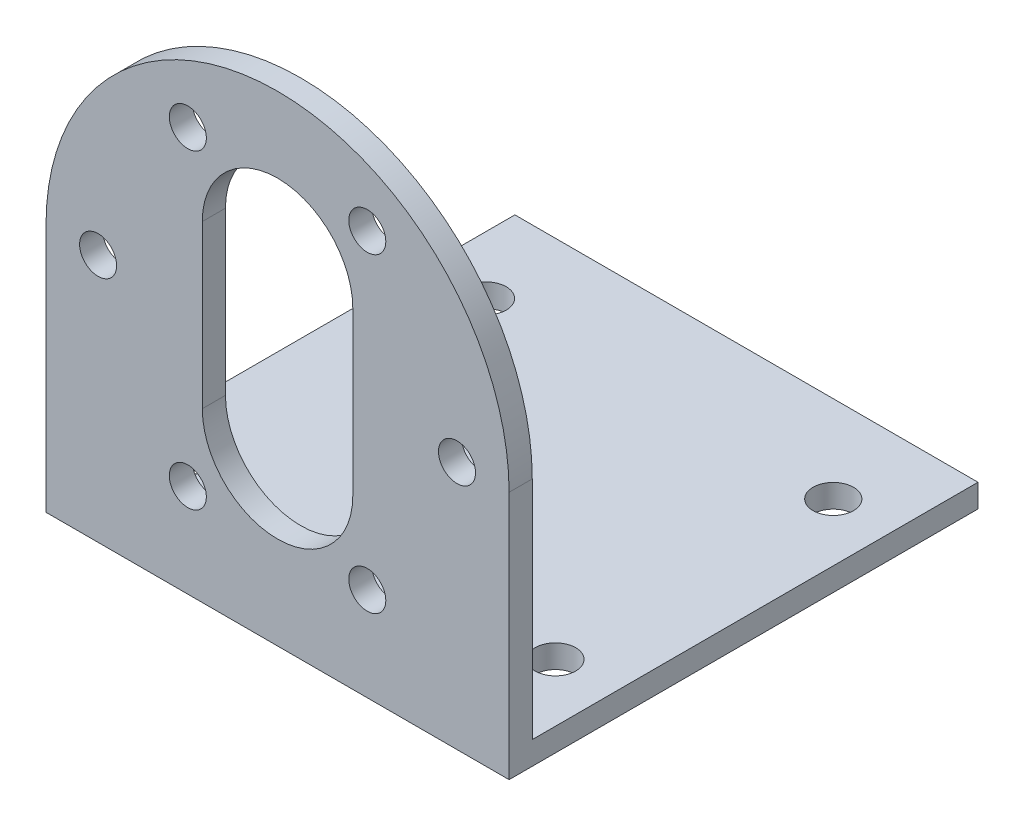
from build123d import *

# Parameters (mm, degrees)
EXTRUDE_1_DEPTH             = 40.5
SKETCH_2_W                  = 38.5
SKETCH_2_H                  = 19.5
CUT_EXTRUDE_1_DEPTH         = 60.752092014
CUT_EXTRUDE_2_DEPTH         = 2
HOLE_WIZARD_3_5_3_5_1_D     = 3.5
HOLE_WIZARD_3_5_3_5_1_DEPTH = 2
HOLE_WIZARD_3_2_3_2_1_D     = 3.2
HOLE_WIZARD_3_2_3_2_1_DEPTH = 40.5
SKETCH_12_R                 = 1.6
CUT_EXTRUDE_3_DEPTH         = 38.5


with BuildPart() as part:
    # 草图1 → 凸台-拉伸1 (new body)
    with BuildSketch(Plane.XY.offset(20.25)):
        with BuildLine():
            Line((20, -2), (20, 19.5))
            ThreePointArc((20, 19.5), (0, 39.5), (-20, 19.5))
            Line((-20, 19.5), (-20, -2))
            Line((-20, -2), (20, -2))
        make_face()
    extrude(amount=-EXTRUDE_1_DEPTH)

    # 草图2 → 切除-拉伸1 (cut, through all)
    with BuildSketch(Plane(origin=(20, 0, 0), x_dir=(0, 0, -1), z_dir=(1, 0, 0))):
        with Locations((1, 9.75)):
            Rectangle(SKETCH_2_W, SKETCH_2_H)
    extrude(amount=-CUT_EXTRUDE_1_DEPTH, mode=Mode.SUBTRACT)

    # 草图3 → 切除-拉伸2 (cut)
    with BuildSketch(Plane.XY.offset(20.25)):
        with BuildLine():
            Line((-6.5, 26.5), (-6.5, 12.5))
            ThreePointArc((-6.5, 12.5), (0, 6), (6.5, 12.5))
            Line((6.5, 12.5), (6.5, 26.5))
            ThreePointArc((6.5, 26.5), (0, 33), (-6.5, 26.5))
        make_face()
    extrude(amount=-CUT_EXTRUDE_2_DEPTH, mode=Mode.SUBTRACT)

    # Ø3.5 (3.5) 直径孔1
    with Locations(Plane(origin=(0, -2, 0), x_dir=(-1, 0, 0), z_dir=(0, -1, 0))):
        with Locations((15, -11.25), (15, 12.75), (-15, 12.75), (-15, -11.25)):
            Hole(HOLE_WIZARD_3_5_3_5_1_D / 2, depth=HOLE_WIZARD_3_5_3_5_1_DEPTH)

    # Ø3.2 (3.2) 直径孔1
    with Locations(Plane.XY.offset(20.25)):
        with Locations((-7.75, 32.923393759), (-7.75, 6.076606241), (15.5, 19.5), (7.75, 6.076606241), (-15.5, 19.5), (7.75, 32.923393759)):
            Hole(HOLE_WIZARD_3_2_3_2_1_D / 2, depth=HOLE_WIZARD_3_2_3_2_1_DEPTH)

    # 草图12 → 切除-拉伸3 (cut)
    with BuildSketch(Plane(origin=(0, 0, -20.25), x_dir=(-1, 0, 0), z_dir=(0, 0, -1))):
        with BuildLine():
            Line((-20, 19.5), (-17.1, 19.5))
            ThreePointArc((-17.1, 19.5), (-15.5, 21.1), (-13.9, 19.5))
            Line((-13.9, 19.5), (13.9, 19.5))
            ThreePointArc((13.9, 19.5), (15.5, 21.1), (17.1, 19.5))
            Line((17.1, 19.5), (20, 19.5))
            ThreePointArc((20, 19.5), (0, 39.5), (-20, 19.5))
        make_face()
        with Locations(Location((-7.75, 32.923393759, 0), (0, 0, 180))):
            Circle(SKETCH_12_R, mode=Mode.SUBTRACT)
        with Locations(Location((7.75, 32.923393759, 0), (0, 0, 180))):
            Circle(SKETCH_12_R, mode=Mode.SUBTRACT)
    extrude(amount=-CUT_EXTRUDE_3_DEPTH, mode=Mode.SUBTRACT)


solid = part.part
